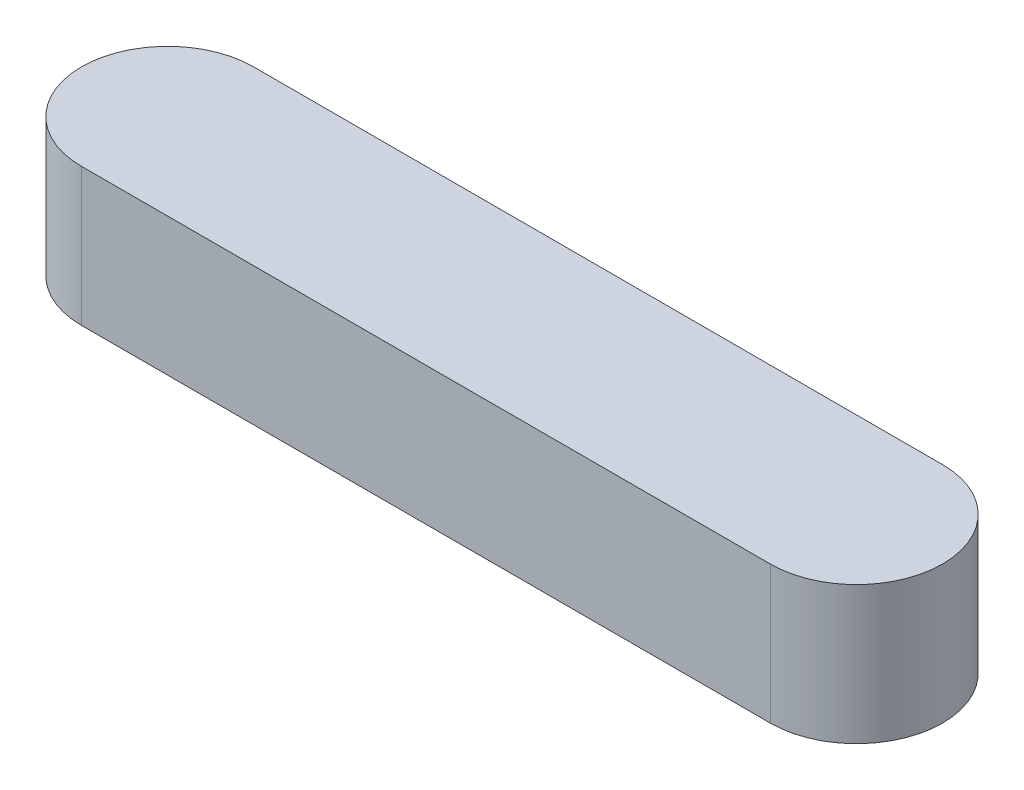
from build123d import *

# Parameters (mm, degrees)
EXTRUDE_1_DEPTH = 8


with BuildPart() as part:
    # Эскиз1 → Бобышка-Вытянуть1 (new body)
    with BuildSketch(Plane(origin=(0, 0, 0), x_dir=(1, 0, 0), z_dir=(0, 1, 0))):
        with BuildLine():
            Line((-20, 5), (20, 5))
            ThreePointArc((20, 5), (25, 0), (20, -5))
            Line((20, -5), (-20, -5))
            ThreePointArc((-20, -5), (-25, 0), (-20, 5))
        make_face()
    extrude(amount=EXTRUDE_1_DEPTH)


solid = part.part
